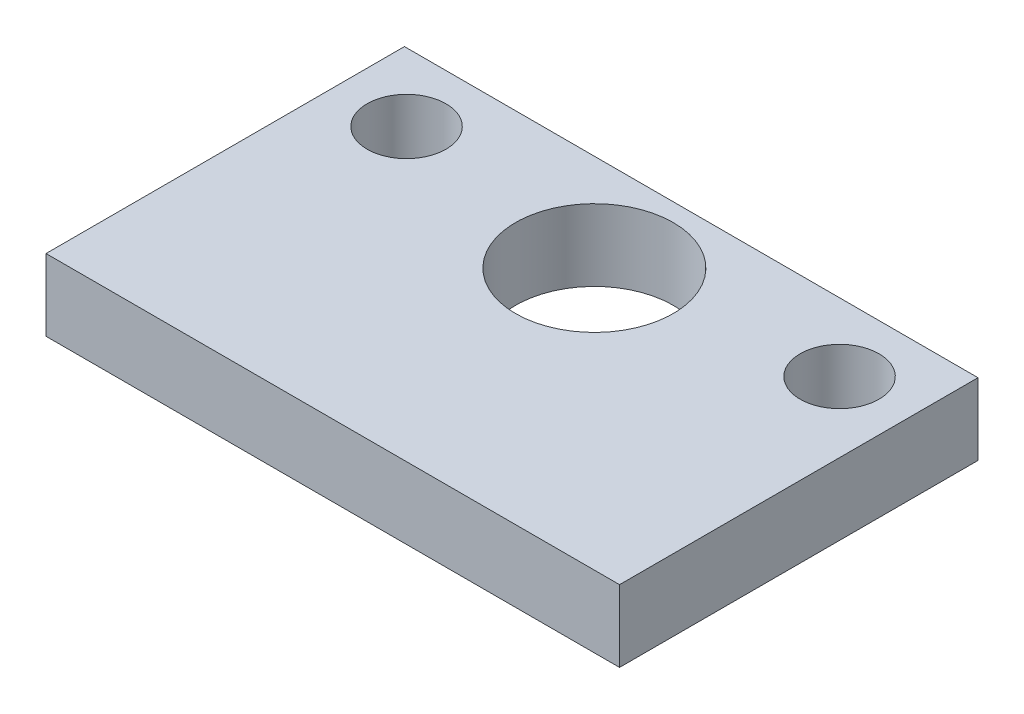
from build123d import *

# Parameters (mm, degrees)
SKETCH1_W           = 80
SKETCH1_H           = 50
BOSS_EXTRUDE1_DEPTH = 10
SKETCH2_R           = 5.5
SKETCH2_R_2         = 11
CUT_EXTRUDE1_DEPTH  = 53.440442409
SKETCH3_R           = 10
CUT_EXTRUDE2_DEPTH  = 5


with BuildPart() as part:
    # Sketch1 → Boss-Extrude1 (new body)
    with BuildSketch(Plane(origin=(0, 0, 0), x_dir=(1, 0, 0), z_dir=(0, 1, 0))):
        with Locations((5, 0)):
            Rectangle(SKETCH1_W, SKETCH1_H)
    extrude(amount=BOSS_EXTRUDE1_DEPTH)

    # Sketch2 → Cut-Extrude1 (cut, through all)
    with BuildSketch(Plane(origin=(0, 10, 0), x_dir=(1, 0, 0), z_dir=(0, 1, 0))):
        with Locations(Location((-25.20025306, 15.49130346, 0), (0, 0, 270))):
            Circle(SKETCH2_R)
        with Locations(Location((35.2, 15.49130346, 0), (0, 0, 90))):
            Circle(SKETCH2_R)
        with Locations(Location((5, 11.49130346, 0), (0, 0, 270))):
            Circle(SKETCH2_R_2)
    extrude(amount=-CUT_EXTRUDE1_DEPTH, mode=Mode.SUBTRACT)

    # Sketch3 → Cut-Extrude2 (cut)
    with BuildSketch(Plane.XZ):
        with Locations(Location((5, 13, 0), (0, 0, 270))):
            Circle(SKETCH3_R)
    extrude(amount=-CUT_EXTRUDE2_DEPTH, mode=Mode.SUBTRACT)


solid = part.part
